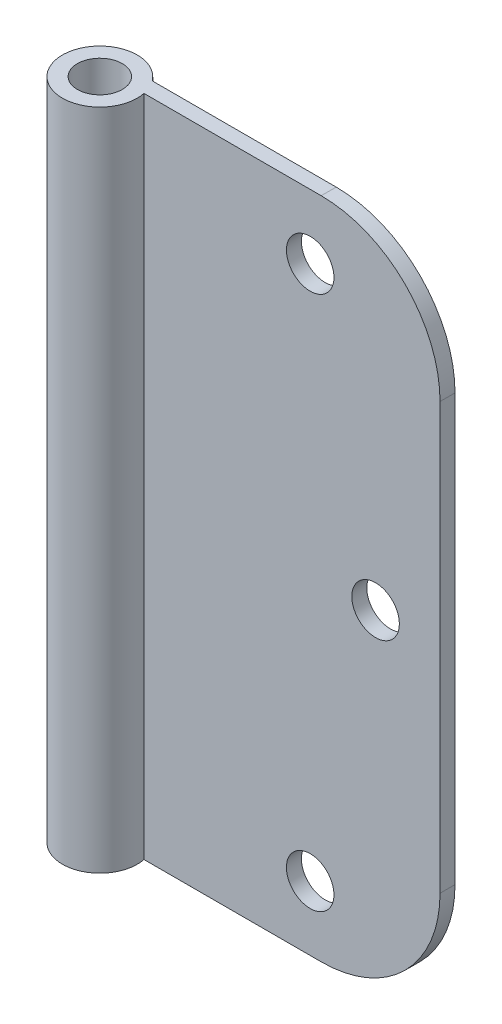
from build123d import *

# Parameters (mm, degrees)
ESQUISSE1_W        = 39.45
ESQUISSE1_H        = 88.646
ESQUISSE1_R        = 3.175
BOSS_EXTRU_1_DEPTH = 2
CONG_1_R           = 15.875
ESQUISSE3_R        = 3
BOSS_EXTRU_2_DEPTH = 88.646


with BuildPart() as part:
    # Esquisse1 → Boss.-Extru.1 (new body)
    with BuildSketch(Plane.XY):
        with Locations((69.175, -44.323)):
            Rectangle(ESQUISSE1_W, ESQUISSE1_H)
        with Locations((80.2894, -44.323)):
            Circle(ESQUISSE1_R, mode=Mode.SUBTRACT)
        with Locations((71.5518, -8.61)):
            Circle(ESQUISSE1_R, mode=Mode.SUBTRACT)
        with Locations(Location((71.5518, -80.036, 0), (0, 0, 180))):
            Circle(ESQUISSE1_R, mode=Mode.SUBTRACT)
    extrude(amount=BOSS_EXTRU_1_DEPTH)

    # Congé1
    cong_1_edges = [part.edges().sort_by_distance(p)[0] for p in [
        (88.9, -88.646, 1),
        (88.9, 0, 1),
    ]]
    fillet(cong_1_edges, radius=CONG_1_R)

    # Esquisse3 → Boss.-Extru.2 (add)
    with BuildSketch(Plane(origin=(0, 0, 0), x_dir=(1, 0, 0), z_dir=(0, 1, 0))):
        with BuildLine():
            Line((49.45, 0), (48.45, 0))
            ThreePointArc((48.45, 0), (39.889522068, -5.049888053), (49.348979486, -2))
            Line((49.348979486, -2), (49.45, -2))
            Line((49.45, -2), (49.45, 0))
        make_face()
        with Locations(Location((44.45, -3, 0), (0, 0, 180))):
            Circle(ESQUISSE3_R, mode=Mode.SUBTRACT)
    extrude(amount=-BOSS_EXTRU_2_DEPTH)


solid = part.part
